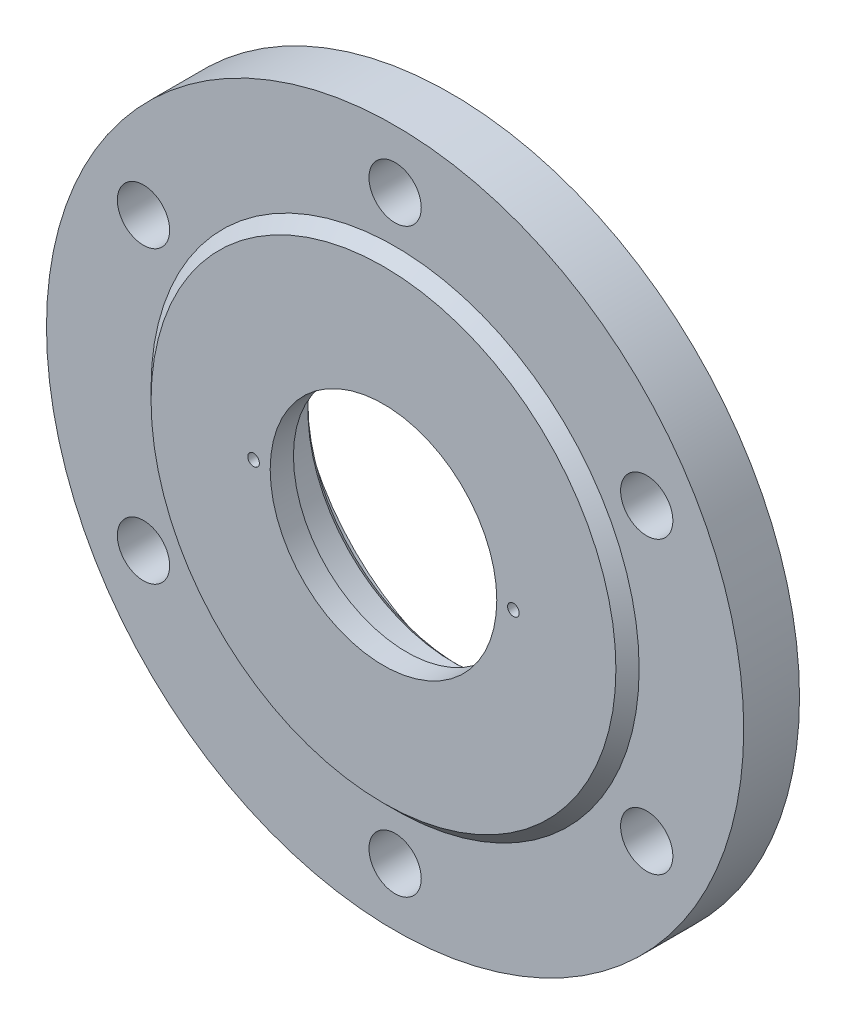
from build123d import *

# Parameters (mm, degrees)
CUT_EXTRUDE1_REACH = 88.71
SKETCH6_R          = 4.5
CUT_EXTRUDE2_REACH = 89.144
SKETCH10_R         = 1


with BuildPart() as part:
    # Sketch1 → Revolve1 (revolve)
    with BuildSketch(Plane(origin=(0, 0, 0), x_dir=(0, 0, -1), z_dir=(1, 0, 0))):
        with BuildLine():
            Line((0, 19.5), (0, 40))
            Line((0, 40), (2, 42))
            Line((2, 42), (2, 60))
            Line((2, 60), (11.6, 60))
            Line((11.6, 60), (11.6, 40))
            Line((11.6, 40), (16.6, 40))
            ThreePointArc((16.6, 40), (16.892893219, 39.292893219), (17.6, 39))
            Line((17.6, 39), (19.85, 39))
            Line((19.85, 39), (19.85, 35))
            Line((19.85, 35), (14, 35))
            ThreePointArc((14, 35), (13.292893219, 34.707106781), (13, 34))
            Line((13, 34), (13, 26))
            Line((13, 26), (12, 25))
            Line((12, 25), (4, 25))
            Line((4, 25), (4, 19.5))
            Line((4, 19.5), (0, 19.5))
        make_face()
    revolve(axis=Axis((0, 0, 0), (0, 0, -1)))

    # Sketch6 → Cut-Extrude1 (cut, up to next)
    with BuildSketch(Plane.XY.offset(-2), mode=Mode.PRIVATE) as cut_extrude1_sk1:
        with Locations((0, -50)):
            Circle(SKETCH6_R)
    cut_extrude1_tool1 = extrude(cut_extrude1_sk1.sketch, amount=-CUT_EXTRUDE1_REACH, mode=Mode.PRIVATE) & part.part
    # Sketch6 → Cut-Extrude1 (cut, up to next)
    with BuildSketch(Plane.XY.offset(-2), mode=Mode.PRIVATE) as cut_extrude1_sk2:
        with Locations((-43.301270189, -25)):
            Circle(SKETCH6_R)
    cut_extrude1_tool2 = extrude(cut_extrude1_sk2.sketch, amount=-CUT_EXTRUDE1_REACH, mode=Mode.PRIVATE) & part.part
    # Sketch6 → Cut-Extrude1 (cut, up to next)
    with BuildSketch(Plane.XY.offset(-2), mode=Mode.PRIVATE) as cut_extrude1_sk3:
        with Locations((-43.301270189, 25)):
            Circle(SKETCH6_R)
    cut_extrude1_tool3 = extrude(cut_extrude1_sk3.sketch, amount=-CUT_EXTRUDE1_REACH, mode=Mode.PRIVATE) & part.part
    # Sketch6 → Cut-Extrude1 (cut, up to next)
    with BuildSketch(Plane.XY.offset(-2), mode=Mode.PRIVATE) as cut_extrude1_sk4:
        with Locations((0, 50)):
            Circle(SKETCH6_R)
    cut_extrude1_tool4 = extrude(cut_extrude1_sk4.sketch, amount=-CUT_EXTRUDE1_REACH, mode=Mode.PRIVATE) & part.part
    # Sketch6 → Cut-Extrude1 (cut, up to next)
    with BuildSketch(Plane.XY.offset(-2), mode=Mode.PRIVATE) as cut_extrude1_sk5:
        with Locations((43.301270189, 25)):
            Circle(SKETCH6_R)
    cut_extrude1_tool5 = extrude(cut_extrude1_sk5.sketch, amount=-CUT_EXTRUDE1_REACH, mode=Mode.PRIVATE) & part.part
    # Sketch6 → Cut-Extrude1 (cut, up to next)
    with BuildSketch(Plane.XY.offset(-2), mode=Mode.PRIVATE) as cut_extrude1_sk6:
        with Locations((43.301270189, -25)):
            Circle(SKETCH6_R)
    cut_extrude1_tool6 = extrude(cut_extrude1_sk6.sketch, amount=-CUT_EXTRUDE1_REACH, mode=Mode.PRIVATE) & part.part
    add(cut_extrude1_tool1.solids().sort_by_distance((0, -50, -2))[0], mode=Mode.SUBTRACT)
    add(cut_extrude1_tool2.solids().sort_by_distance((-43.30127, -25, -2))[0], mode=Mode.SUBTRACT)
    add(cut_extrude1_tool3.solids().sort_by_distance((-43.30127, 25, -2))[0], mode=Mode.SUBTRACT)
    add(cut_extrude1_tool4.solids().sort_by_distance((0, 50, -2))[0], mode=Mode.SUBTRACT)
    add(cut_extrude1_tool5.solids().sort_by_distance((43.30127, 25, -2))[0], mode=Mode.SUBTRACT)
    add(cut_extrude1_tool6.solids().sort_by_distance((43.30127, -25, -2))[0], mode=Mode.SUBTRACT)

    # Sketch10 → Cut-Extrude2 (cut, up to next)
    with BuildSketch(Plane.XY, mode=Mode.PRIVATE) as cut_extrude2_sk1:
        with Locations((-22.36, 0)):
            Circle(SKETCH10_R)
    cut_extrude2_tool1 = extrude(cut_extrude2_sk1.sketch, amount=-CUT_EXTRUDE2_REACH, mode=Mode.PRIVATE) & part.part
    # Sketch10 → Cut-Extrude2 (cut, up to next)
    with BuildSketch(Plane.XY, mode=Mode.PRIVATE) as cut_extrude2_sk2:
        with Locations((22.36, 0)):
            Circle(SKETCH10_R)
    cut_extrude2_tool2 = extrude(cut_extrude2_sk2.sketch, amount=-CUT_EXTRUDE2_REACH, mode=Mode.PRIVATE) & part.part
    add(cut_extrude2_tool1.solids().sort_by_distance((-22.36, 0, 0))[0], mode=Mode.SUBTRACT)
    add(cut_extrude2_tool2.solids().sort_by_distance((22.36, 0, 0))[0], mode=Mode.SUBTRACT)


solid = part.part
